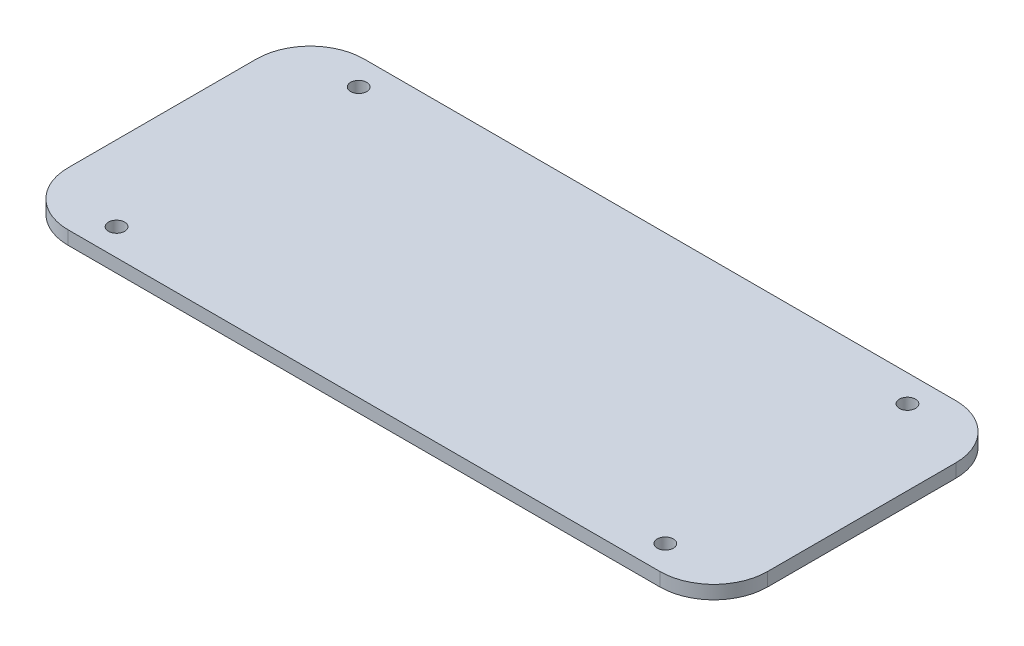
from build123d import *

# Parameters (mm, degrees)
BOSS_EXTRUDE1_DEPTH = 2.5
SKETCH2_R           = 1.5
CUT_EXTRUDE1_DEPTH  = 142.178079035


with BuildPart() as part:
    # Sketch1 → Boss-Extrude1 (new body)
    with BuildSketch(Plane(origin=(0, 0, 0), x_dir=(1, 0, 0), z_dir=(0, 1, 0))):
        with BuildLine():
            Line((10, 0), (120, 0))
            ThreePointArc((120, 0), (127.071067812, 2.928932188), (130, 10))
            Line((130, 10), (130, 45))
            ThreePointArc((130, 45), (127.071067812, 52.071067812), (120, 55))
            Line((120, 55), (10, 55))
            ThreePointArc((10, 55), (2.928932188, 52.071067812), (0, 45))
            Line((0, 45), (0, 10))
            ThreePointArc((0, 10), (2.928932188, 2.928932188), (10, 0))
        make_face()
    extrude(amount=BOSS_EXTRUDE1_DEPTH)

    # Sketch2 → Cut-Extrude1 (cut, through all)
    with BuildSketch(Plane(origin=(0, 2.5, 0), x_dir=(1, 0, 0), z_dir=(0, 1, 0))):
        with Locations(Location((14, 5, 0), (0, 0, 270))):
            Circle(SKETCH2_R)
        with Locations(Location((14, 50, 0), (0, 0, 270))):
            Circle(SKETCH2_R)
        with Locations(Location((116, 5, 0), (0, 0, 90))):
            Circle(SKETCH2_R)
        with Locations(Location((116, 50, 0), (0, 0, 90))):
            Circle(SKETCH2_R)
    extrude(amount=-CUT_EXTRUDE1_DEPTH, mode=Mode.SUBTRACT)


solid = part.part
